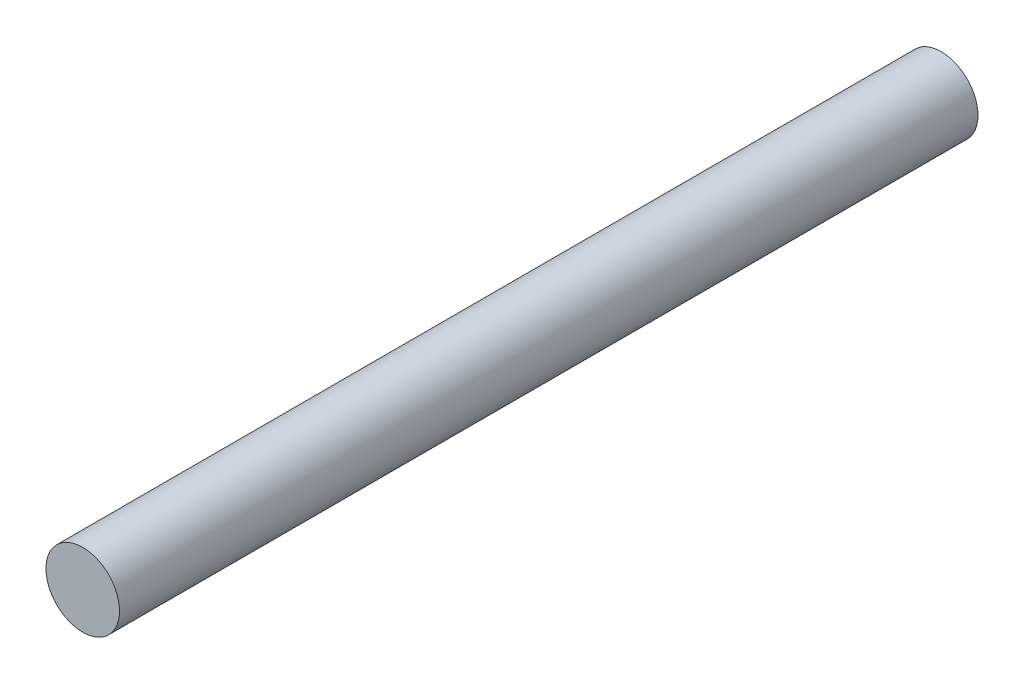
from build123d import *

# Parameters (mm, degrees)
SKETCH_1_R      = 3
EXTRUDE_1_DEPTH = 70


with BuildPart() as part:
    # 草图1 → 凸台-拉伸1 (new body)
    with BuildSketch(Plane.XY):
        Circle(SKETCH_1_R)
    extrude(amount=EXTRUDE_1_DEPTH)


solid = part.part
